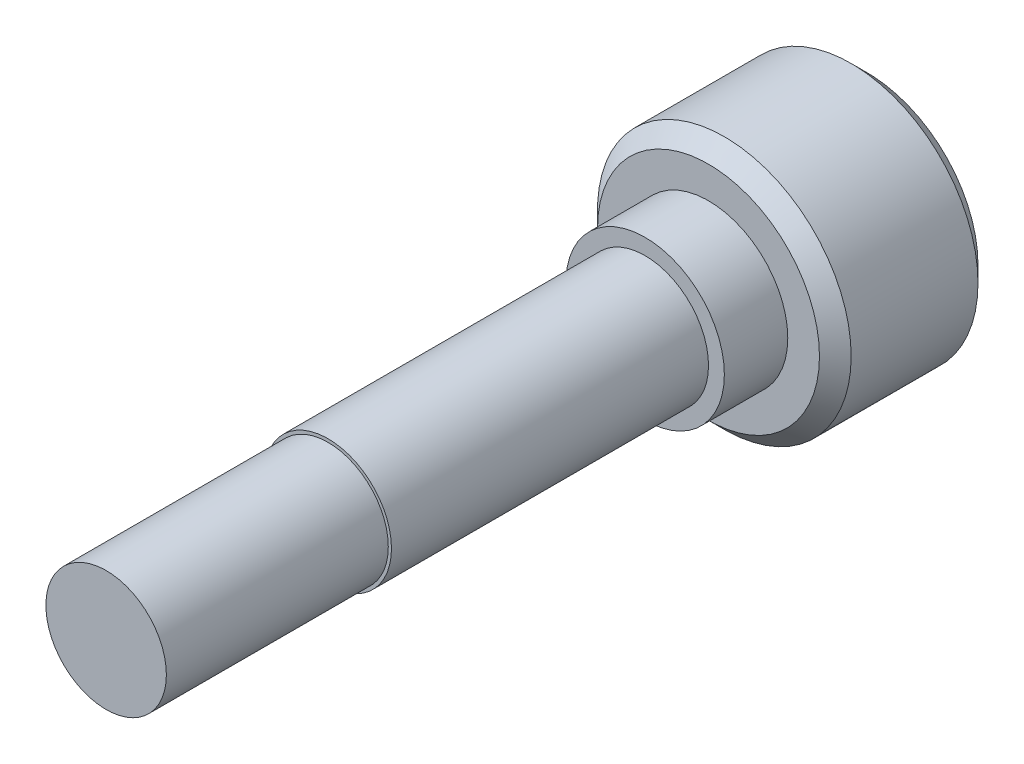
from build123d import *

# Parameters (mm, degrees)
SKETCH_1_R          = 4
EXTRUDE_1_DEPTH     = 5
SKETCH_2_R          = 2.5
EXTRUDE_2_DEPTH     = 2
SKETCH_3_R          = 2
EXTRUDE_3_DEPTH     = 17
CHAMFER_1_SIZE      = 0.5
CHAMFER_2_SIZE      = 0.5
CUT_EXTRUDE_START   = -7
SKETCH_4_R          = 2
SKETCH_4_R_2        = 1.9
CUT_EXTRUDE_1_DEPTH = 7


with BuildPart() as part:
    # 草图1 → 凸台-拉伸1 (new body)
    with BuildSketch(Plane.XY):
        Circle(SKETCH_1_R)
    extrude(amount=EXTRUDE_1_DEPTH)

    # 草图2 → 凸台-拉伸2 (add)
    with BuildSketch(Plane.XY.offset(5)):
        Circle(SKETCH_2_R)
    extrude(amount=EXTRUDE_2_DEPTH)

    # 草图3 → 凸台-拉伸3 (add)
    with BuildSketch(Plane.XY.offset(7)):
        Circle(SKETCH_3_R)
    extrude(amount=EXTRUDE_3_DEPTH)

    # 倒角1
    chamfer_1_edges = [part.edges().sort_by_distance(p)[0] for p in [
        (-4, 0, 0),
    ]]
    chamfer(chamfer_1_edges, length=CHAMFER_1_SIZE)

    # 倒角2
    chamfer_2_edges = [part.edges().sort_by_distance(p)[0] for p in [
        (-4, 0, 5),
    ]]
    chamfer(chamfer_2_edges, length=CHAMFER_2_SIZE)

    # 草图4 → 切除-拉伸1 (cut)
    with BuildSketch(Plane.XY.offset(24).offset(CUT_EXTRUDE_START)):
        Circle(SKETCH_4_R)
        Circle(SKETCH_4_R_2, mode=Mode.SUBTRACT)
    extrude(amount=CUT_EXTRUDE_1_DEPTH, mode=Mode.SUBTRACT)


solid = part.part
